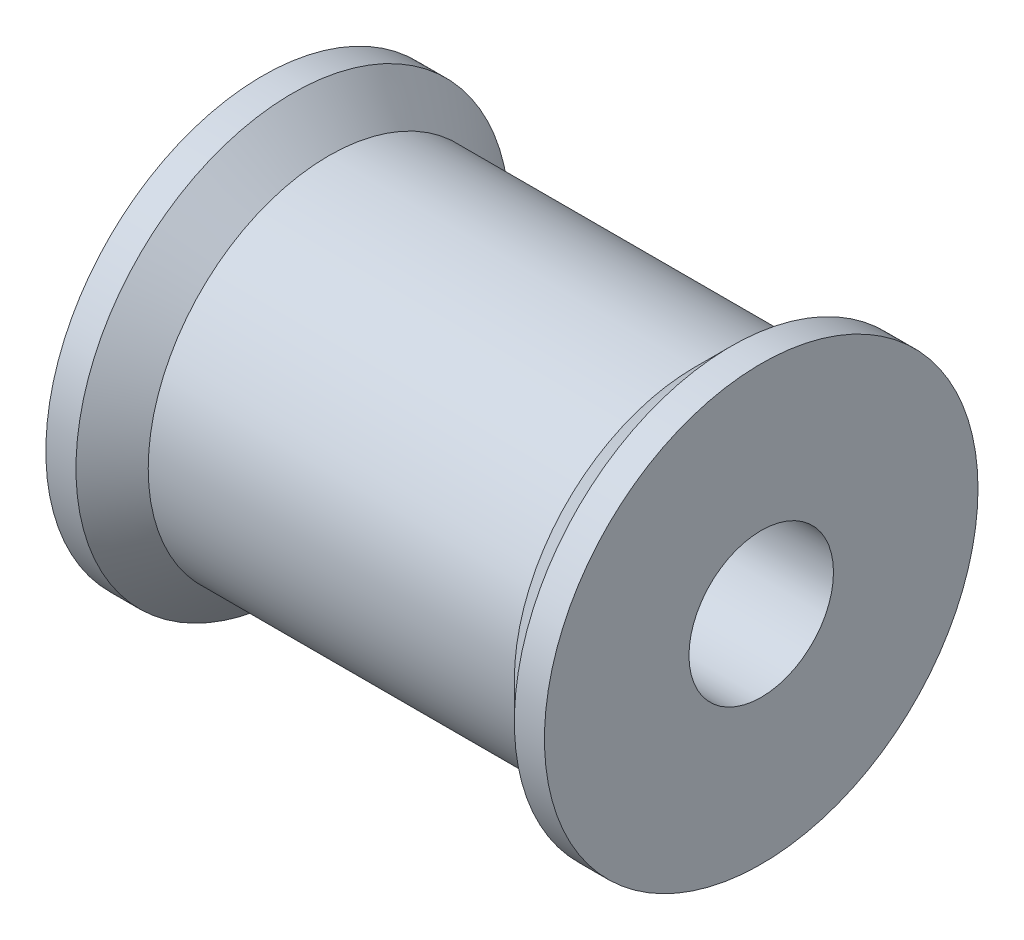
from build123d import *

# Parameters (mm, degrees)
SKETCH3_R          = 3
CUT_EXTRUDE1_DEPTH = 20.7


with BuildPart() as part:
    # Sketch2 → Revolve1 (revolve)
    with BuildSketch(Plane(origin=(0, 0, 0), x_dir=(1, 0, 0), z_dir=(0, 1, 0))):
        Polygon((-10.35, 9), (-9.1, 9), (-7.6, 7.5), (7.6, 7.5), (9.1, 9), (10.35, 9), (10.35, 0), (-10.35, 0), align=None)
    revolve(axis=Axis((10.35, 0, 0), (-1, 0, 0)))

    # Sketch3 → Cut-Extrude1 (cut)
    with BuildSketch(Plane.ZY.offset(10.35)):
        Circle(SKETCH3_R)
    extrude(amount=-CUT_EXTRUDE1_DEPTH, mode=Mode.SUBTRACT)


solid = part.part
